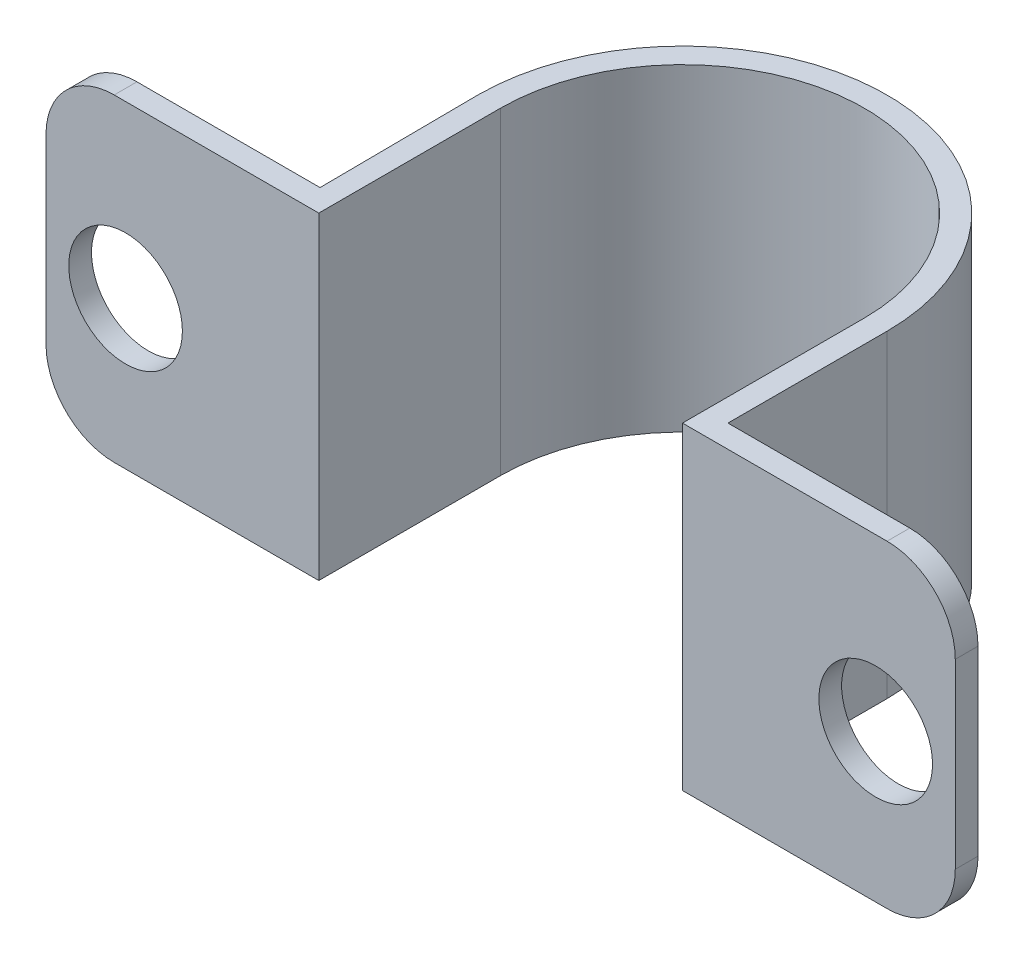
from build123d import *

# Parameters (mm, degrees)
SALIENTE_EXTRUIR1_DEPTH = 14
REDONDEO1_R             = 3
CROQUIS2_R              = 2.5
CORTAR_EXTRUIR1_DEPTH   = 10


with BuildPart() as part:
    # Croquis1 → Saliente-Extruir1 (new body)
    with BuildSketch(Plane(origin=(0, 0, 0), x_dir=(1, 0, 0), z_dir=(0, 1, 0))):
        with BuildLine():
            Line((-20, 0), (-8, 0))
            Line((-8, 0), (-8, 8))
            ThreePointArc((-8, 8), (0, 16), (8, 8))
            Line((8, 8), (8, 0))
            Line((8, 0), (20, 0))
            Line((20, 0), (20, 1))
            Line((20, 1), (9, 1))
            Line((9, 1), (9, 8))
            ThreePointArc((9, 8), (0, 17), (-9, 8))
            Line((-9, 8), (-8.998859232, 7.856708279))
            Line((-8.998859232, 7.856708279), (-8.94427191, 1))
            Line((-8.94427191, 1), (-20, 1))
            Line((-20, 1), (-20, 0))
        make_face()
    extrude(amount=SALIENTE_EXTRUIR1_DEPTH)

    # Redondeo1
    redondeo1_edges = [part.edges().sort_by_distance(p)[0] for p in [
        (-20, 0, -0.5),
        (20, 0, -0.5),
        (20, 14, -0.5),
        (-20, 14, -0.5),
    ]]
    fillet(redondeo1_edges, radius=REDONDEO1_R)

    # Croquis2 → Cortar-Extruir1 (cut)
    with BuildSketch(Plane.XY):
        with Locations((-16.5, 6.5)):
            Circle(CROQUIS2_R)
        with Locations((16.5, 6.5)):
            Circle(CROQUIS2_R)
    extrude(amount=-CORTAR_EXTRUIR1_DEPTH, mode=Mode.SUBTRACT)


solid = part.part
